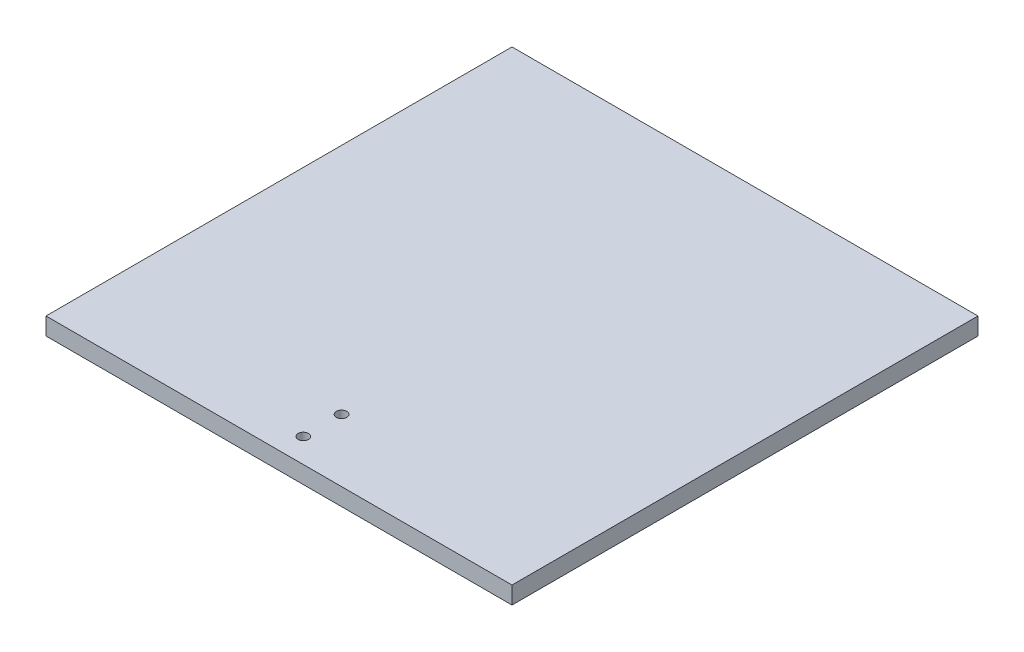
from build123d import *

# Parameters (mm, degrees)
ESBO_O1_W                = 134.07
ESBO_O1_H                = 134.07
RESSALTO_EXTRUS_O1_DEPTH = 5
ESBO_O2_R                = 1.5
CORTE_EXTRUS_O1_DEPTH    = 5


with BuildPart() as part:
    # Esboço1 → Ressalto-extrusão1 (new body)
    with BuildSketch(Plane(origin=(0, 0, 0), x_dir=(1, 0, 0), z_dir=(0, 1, 0))):
        with Locations((34.28824492, -6.698016278)):
            Rectangle(ESBO_O1_W, ESBO_O1_H)
    extrude(amount=RESSALTO_EXTRUS_O1_DEPTH)

    # Esboço2 → Corte-extrusão1 (cut)
    with BuildSketch(Plane(origin=(0, 5, 0), x_dir=(1, 0, 0), z_dir=(0, 1, 0))):
        with Locations(Location((34.28824492, -55.733016278, 0), (0, 0, 270))):
            Circle(ESBO_O2_R)
        with Locations(Location((34.28824492, -66.733016278, 0), (0, 0, 270))):
            Circle(ESBO_O2_R)
    extrude(amount=-CORTE_EXTRUS_O1_DEPTH, mode=Mode.SUBTRACT)


solid = part.part
